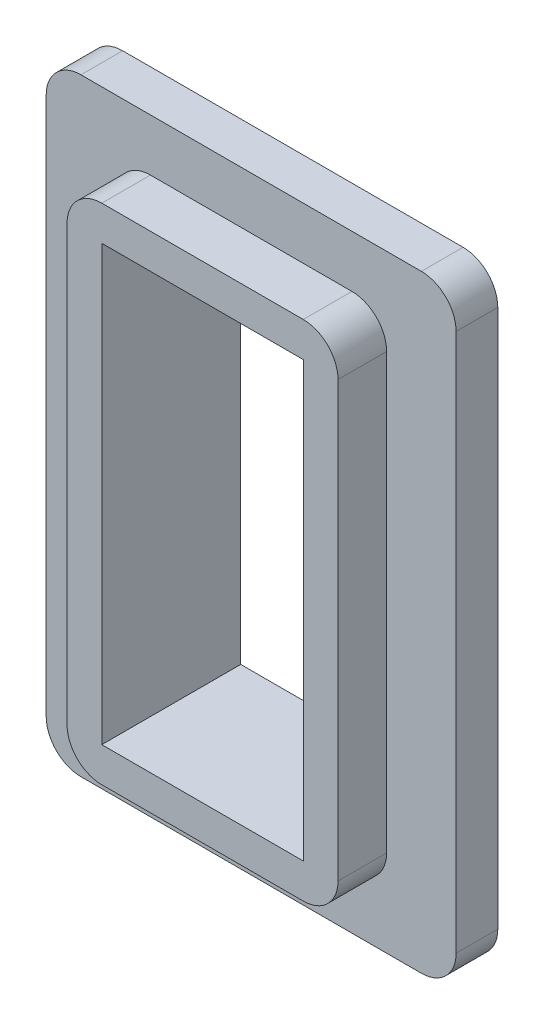
from build123d import *

# Parameters (mm, degrees)
BOSS_EXTRUDE1_DEPTH      = 0.6
BOSS_EXTRUDE1_DEPTH_BACK = 0.6
SKETCH1_W                = 11.8
SKETCH1_H                = 17.5
BOSS_EXTRUDE2_DEPTH      = 2
BOSS_EXTRUDE2_DEPTH_BACK = 2
SKETCH1_3_W              = 7.8
SKETCH1_3_H              = 14.5
SKETCH1_3_W_2            = 5.8
SKETCH1_3_H_2            = 12.5
CUT_EXTRUDE1_DEPTH       = 11.741159155
CUT_EXTRUDE1_DEPTH_BACK  = 11.741159155
SKETCH1_4_W              = 5.8
SKETCH1_4_H              = 12.5
FILLET1_R                = 1


with BuildPart() as part:
    # Sketch1 → Boss-Extrude1 (new, two sides: drawn at the far end of the back side and taken through both)
    with BuildSketch(Plane.XY.offset(-BOSS_EXTRUDE1_DEPTH_BACK)):
        Rectangle(SKETCH1_W, SKETCH1_H)
    extrude(amount=BOSS_EXTRUDE1_DEPTH + BOSS_EXTRUDE1_DEPTH_BACK)

    # Sketch1<3> → Boss-Extrude2 (add, two sides: drawn at the far end of the back side and taken through both)
    with BuildSketch(Plane.XY.offset(-BOSS_EXTRUDE2_DEPTH_BACK)):
        Rectangle(SKETCH1_3_W, SKETCH1_3_H)
        Rectangle(SKETCH1_3_W_2, SKETCH1_3_H_2, mode=Mode.SUBTRACT)
    extrude(amount=BOSS_EXTRUDE2_DEPTH + BOSS_EXTRUDE2_DEPTH_BACK)

    # Sketch1<4> → Cut-Extrude1 (cut, two sides: drawn at the far end of the back side and taken through both)
    with BuildSketch(Plane.XY.offset(-CUT_EXTRUDE1_DEPTH_BACK)):
        Rectangle(SKETCH1_4_W, SKETCH1_4_H)
    extrude(amount=CUT_EXTRUDE1_DEPTH + CUT_EXTRUDE1_DEPTH_BACK, mode=Mode.SUBTRACT)

    # Fillet1
    fillet1_edges = [part.edges().sort_by_distance(p)[0] for p in [
        (-3.9, 7.25, -1.3),
        (3.9, 7.25, -1.3),
        (3.9, -7.25, -1.3),
        (-3.9, -7.25, -1.3),
        (-5.9, -8.75, 0),
        (5.9, -8.75, 0),
        (3.9, -7.25, 1.3),
        (-3.9, -7.25, 1.3),
        (-3.9, 7.25, 1.3),
        (3.9, 7.25, 1.3),
        (5.9, 8.75, 0),
        (-5.9, 8.75, 0),
    ]]
    fillet(fillet1_edges, radius=FILLET1_R)


solid = part.part
